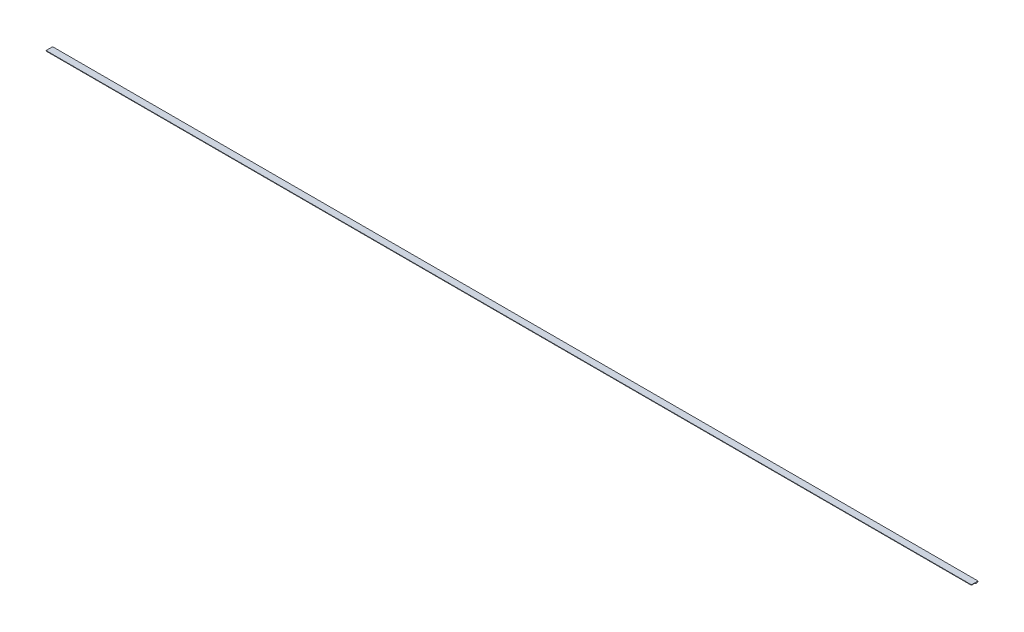
from build123d import *

# Parameters (mm, degrees)
SKETCH1_RX          = 1.005186148
SKETCH1_RY          = 0.387209531
BOSS_EXTRUDE1_DEPTH = 1540


with BuildPart() as part:
    # Sketch1 → Boss-Extrude1 (new body)
    with BuildSketch(Plane(origin=(0, 0, 0), x_dir=(0, 0, -1), z_dir=(1, 0, 0))):
        with BuildLine():
            Line((-28.473958333, 0), (-17.473958333, 0))
            Line((-17.473958333, 0), (-17.473958333, -0.759392904))
            add(Edge.make_bspline(
                [(-17.473958333, -0.759392904), (-20.336907656, -3.394513912), (-23.199856978, -0.759392904)],
                knots=[0, 0, 0, 1, 1, 1], degree=2))
            Line((-23.199856978, -0.759392904), (-28.473958333, -0.759392904))
            Line((-28.473958333, -0.759392904), (-28.473958333, 0))
        make_face()
        with Locations((-20.336907656, -0.759392904)):
            Ellipse(SKETCH1_RX, SKETCH1_RY, mode=Mode.SUBTRACT)
    extrude(amount=BOSS_EXTRUDE1_DEPTH)


solid = part.part
